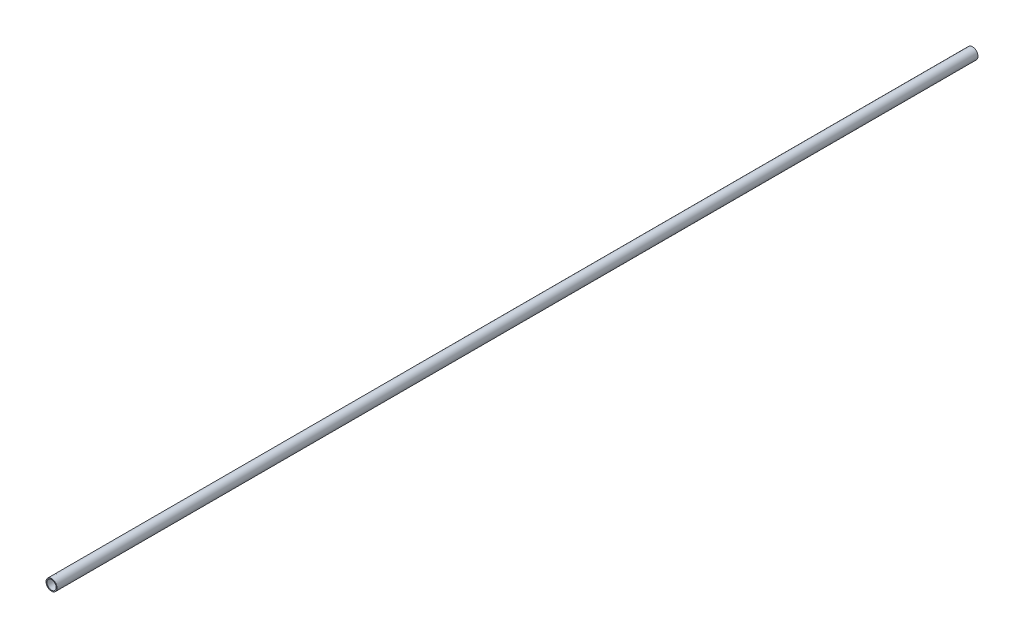
from build123d import *

# Parameters (mm, degrees)
SKETCH_1_R      = 6
SKETCH_1_R_2    = 5
EXTRUDE_1_DEPTH = 500


with BuildPart() as part:
    # Эскиз1 → Бобышка-Вытянуть1 (new, symmetric)
    with BuildSketch(Plane.XY):
        Circle(SKETCH_1_R)
        Circle(SKETCH_1_R_2, mode=Mode.SUBTRACT)
    extrude(amount=EXTRUDE_1_DEPTH, both=True)


solid = part.part
